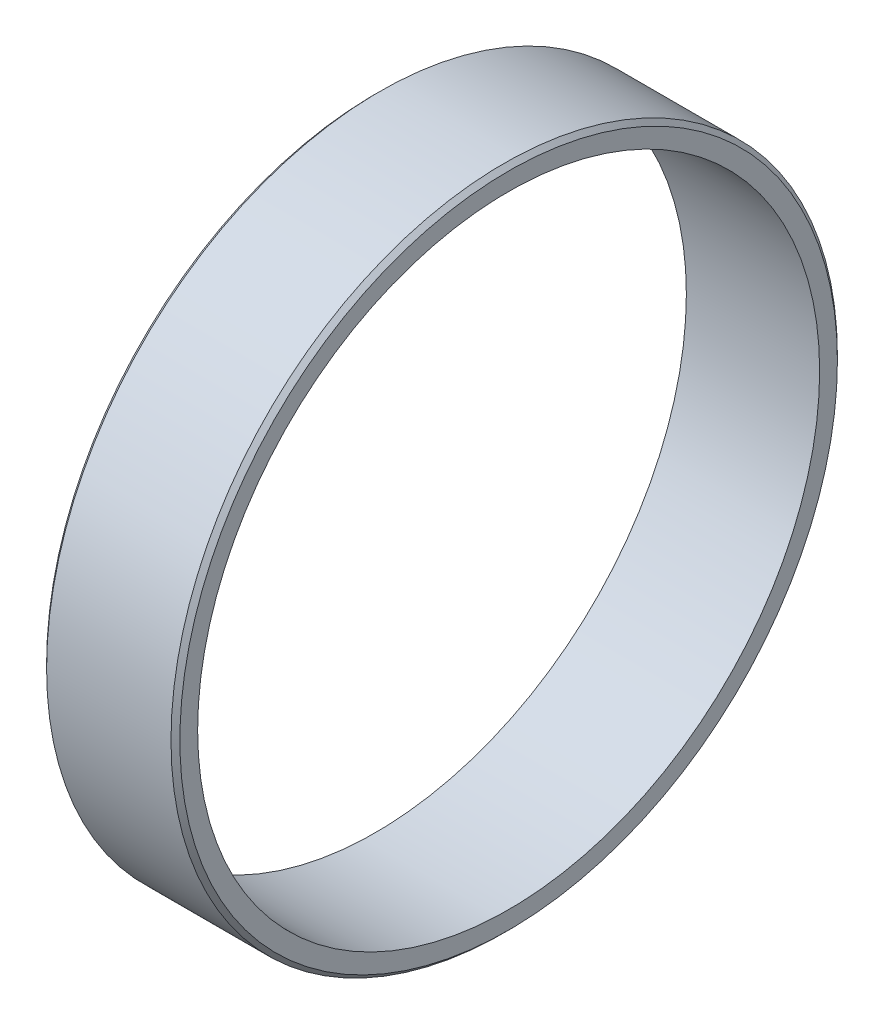
from build123d import *

# Parameters (mm, degrees)
SKETCH1_W     = 15
SKETCH1_H     = 2.5
CHAMFER1_SIZE = 0.5


with BuildPart() as part:
    # Sketch1 → Revolve1 (revolve)
    with BuildSketch(Plane.XY, mode=Mode.PRIVATE) as revolve1_sk:
        with Locations((0, -36.25)):
            Rectangle(SKETCH1_W, SKETCH1_H)
    revolve(revolve1_sk.sketch.rotate(Axis((-29.392494898, 0, 0), (1, 0, 0)), 270), axis=Axis((-29.392494898, 0, 0), (1, 0, 0)))

    # Chamfer1
    chamfer1_edges = [part.edges().sort_by_distance(p)[0] for p in [
        (7.5, 0, -37.5),
        (-7.5, 0, -37.5),
    ]]
    chamfer(chamfer1_edges, length=CHAMFER1_SIZE)


solid = part.part
